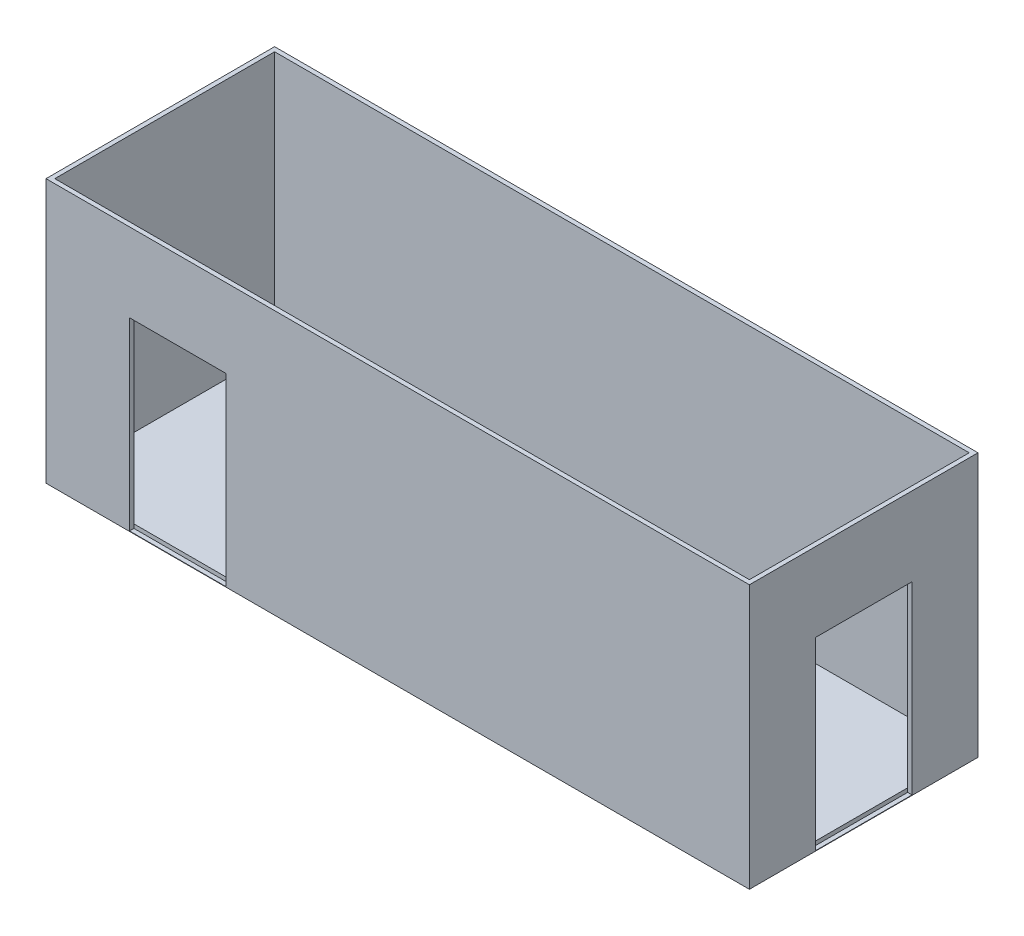
from build123d import *

# Parameters (mm, degrees)
SKETCH2_W           = 8000
SKETCH2_H           = 2600
BOSS_EXTRUDE1_DEPTH = 3000
SHELL1_T            = -50
SKETCH3_W           = 1100
SKETCH3_H           = 2100
CUT_EXTRUDE1_DEPTH  = 50
SKETCH4_W           = 1100
SKETCH4_H           = 2100
CUT_EXTRUDE2_DEPTH  = 50


with BuildPart() as part:
    # Sketch2 → Boss-Extrude1 (new body)
    with BuildSketch(Plane(origin=(0, 0, 0), x_dir=(1, 0, 0), z_dir=(0, 1, 0))):
        Rectangle(SKETCH2_W, SKETCH2_H)
    extrude(amount=BOSS_EXTRUDE1_DEPTH)

    # Shell1
    shell1_openings = [part.faces().sort_by_distance(p)[0] for p in [
        (0, 3000, 0),
    ]]
    offset(amount=SHELL1_T, openings=shell1_openings, kind=Kind.INTERSECTION)

    # Sketch3 → Cut-Extrude1 (cut)
    with BuildSketch(Plane.XY.offset(1300)):
        with Locations((-2500, 1055)):
            Rectangle(SKETCH3_W, SKETCH3_H)
    extrude(amount=-CUT_EXTRUDE1_DEPTH, mode=Mode.SUBTRACT)

    # Sketch4 → Cut-Extrude2 (cut)
    with BuildSketch(Plane(origin=(4000, 0, 0), x_dir=(0, 0, -1), z_dir=(1, 0, 0))):
        with Locations((0, 1055)):
            Rectangle(SKETCH4_W, SKETCH4_H)
    extrude(amount=-CUT_EXTRUDE2_DEPTH, mode=Mode.SUBTRACT)


solid = part.part
